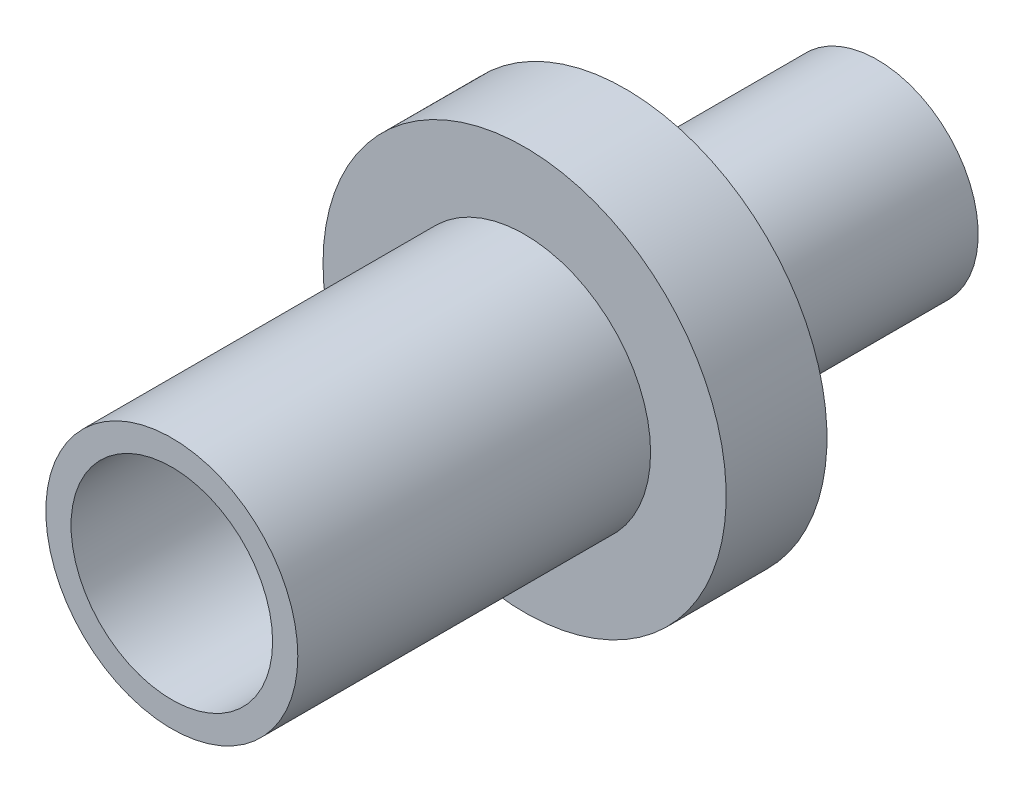
from build123d import *

# Parameters (mm, degrees)
BOSS_EXTRUDE1_DEPTH      = 4
BOSS_EXTRUDE1_DEPTH_BACK = 3
SKETCH1_R                = 2.5
SKETCH2_R                = 4
BOSS_EXTRUDE2_DEPTH      = 2
SKETCH3_R                = 2
CUT_EXTRUDE1_DEPTH       = 5
SKETCH4_R                = 2
BOSS_EXTRUDE3_DEPTH      = 5


with BuildPart() as part:
    # Sketch1 → Boss-Extrude1 (new, two sides: drawn at the far end of the back side and taken through both)
    with BuildSketch(Plane.XY.offset(-BOSS_EXTRUDE1_DEPTH_BACK)):
        with Locations((-68.585871194, -90)):
            Circle(SKETCH1_R)
    extrude(amount=BOSS_EXTRUDE1_DEPTH + BOSS_EXTRUDE1_DEPTH_BACK)

    # Sketch2 → Boss-Extrude2 (add)
    with BuildSketch(Plane(origin=(0, 0, -3), x_dir=(-1, 0, 0), z_dir=(0, 0, -1))):
        with Locations((68.585871194, -90)):
            Circle(SKETCH2_R)
    extrude(amount=BOSS_EXTRUDE2_DEPTH)

    # Sketch3 → Cut-Extrude1 (cut)
    with BuildSketch(Plane.XY.offset(4)):
        with Locations((-68.585871194, -90)):
            Circle(SKETCH3_R)
    extrude(amount=-CUT_EXTRUDE1_DEPTH, mode=Mode.SUBTRACT)

    # Sketch4 → Boss-Extrude3 (add)
    with BuildSketch(Plane(origin=(0, 0, -5), x_dir=(-1, 0, 0), z_dir=(0, 0, -1))):
        with Locations((68.585871194, -90)):
            Circle(SKETCH4_R)
    extrude(amount=BOSS_EXTRUDE3_DEPTH)


solid = part.part
